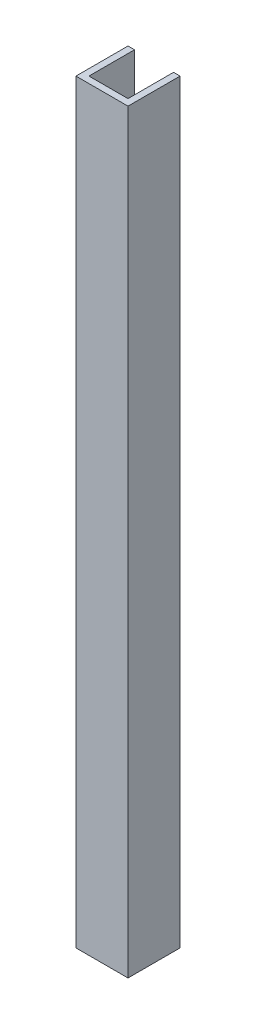
from build123d import *

# Parameters (mm, degrees)
EXTRUDE_THIN1_DEPTH = 368.3


with BuildPart() as part:
    # Sketch1 → Extrude-Thin1 (new body)
    with BuildSketch(Plane(origin=(0, 0, 0), x_dir=(1, 0, 0), z_dir=(0, 1, 0))):
        Polygon((0, 25.4), (0, 0), (25.4, 0), (25.4, 25.4), (22.225, 25.4), (22.225, 3.175), (3.175, 3.175), (3.175, 25.4), align=None)
    extrude(amount=EXTRUDE_THIN1_DEPTH)


solid = part.part
